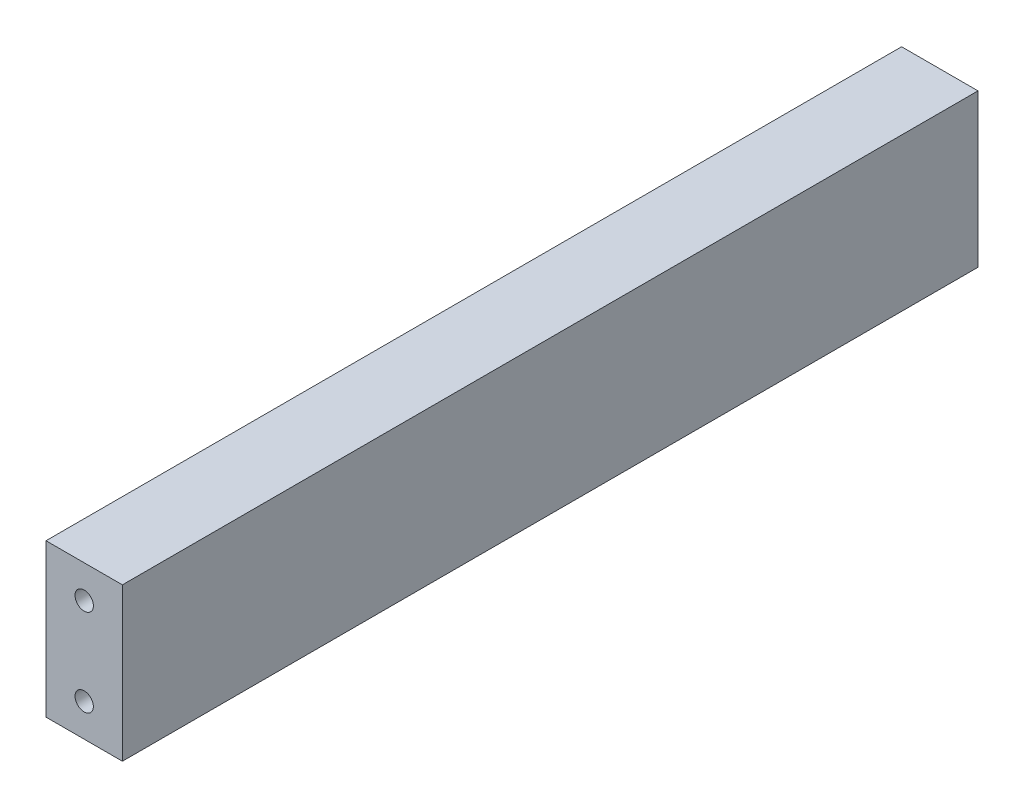
from build123d import *

# Parameters (mm, degrees)
IZIM1_W                     = 17.5
IZIM1_H                     = 35
Y_KSEKLIK_EKSTR_ZYON1_DEPTH = 98
M5_DI_LI_DELIK1_AT_2_COUNT  = 2
M5_DI_LI_DELIK1_AT_2_PITCH  = 20


with BuildPart() as part:
    # Çizim1 → Yükseklik-Ekstrüzyon1 (new, symmetric)
    with BuildSketch(Plane.XY):
        Rectangle(IZIM1_W, IZIM1_H)
    extrude(amount=Y_KSEKLIK_EKSTR_ZYON1_DEPTH, both=True)

    # Çizim3 → M5 Dişli Delik1 (revolve, cut)
    with BuildSketch(Plane(origin=(0, 10, 98), x_dir=(0, -1, 0), z_dir=(1, 0, 0))):
        Polygon((0, 0), (0, 201.2618073), (2.1, 200), (2.1, 0), align=None)
    m5_di_li_delik1 = revolve(axis=Axis((0, 10, 104.35), (0, 0, -1)), mode=Mode.SUBTRACT)

    # M5 Dişli Delik1 at 2: M5 Dişli Delik1 ×2
    with Locations(*[(0, -i * M5_DI_LI_DELIK1_AT_2_PITCH, 0) for i in range(1, M5_DI_LI_DELIK1_AT_2_COUNT)]):
        add(m5_di_li_delik1, mode=Mode.SUBTRACT)

    # Aynalama1: M5 Dişli Delik1 across plane
    add(m5_di_li_delik1.mirror(Plane.XY), mode=Mode.SUBTRACT)

    # Aynalama1 copy 1 sketch → Aynalama1 copy 1 (revolve, cut)
    with BuildSketch(Plane(origin=(0, -10, -98), x_dir=(0, -1, 0), z_dir=(1, 0, 0))):
        Polygon((0, 0), (0, -201.2618073), (2.1, -200), (2.1, 0), align=None)
    revolve(axis=Axis((0, -10, -104.35), (0, 0, -1)), mode=Mode.SUBTRACT)


solid = part.part
